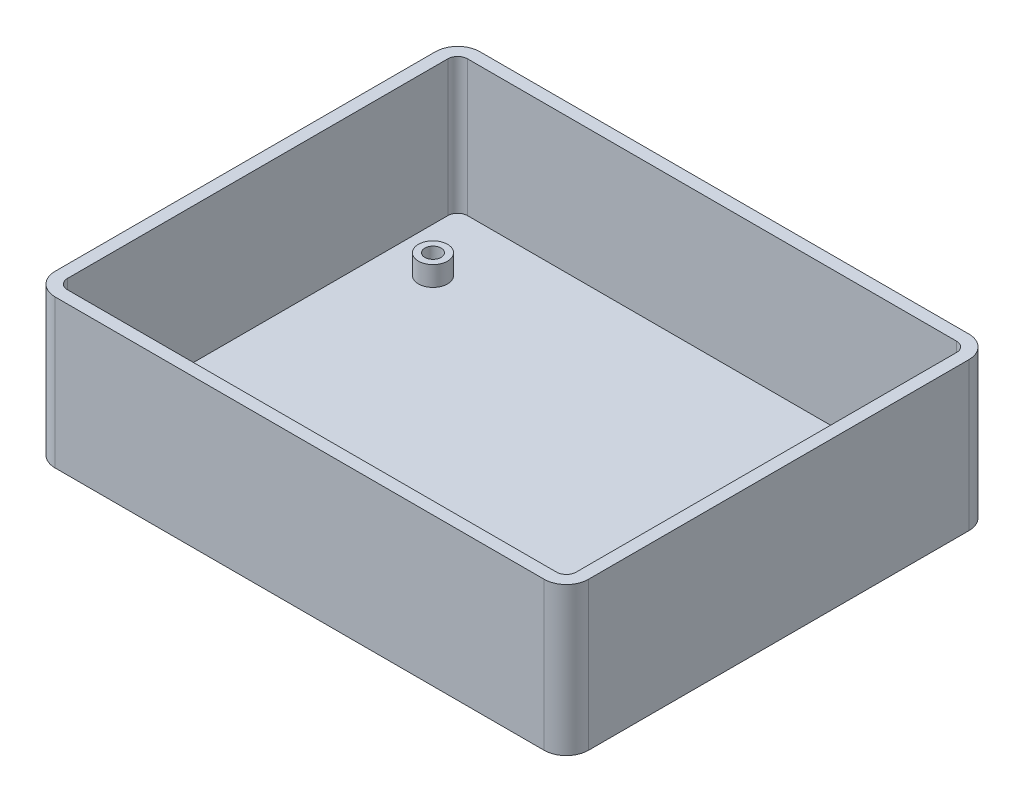
from build123d import *

# Parameters (mm, degrees)
SKETCH_1_W      = 103
SKETCH_1_H      = 81
SKETCH_1_R      = 1.65
EXTRUDE_1_DEPTH = 2.5
FILLET_1_R      = 2
EXTRUDE_START   = -30
EXTRUDE_2_DEPTH = 30
SKETCH_5_R      = 2.95
SKETCH_5_R_2    = 1.65
EXTRUDE_3_DEPTH = 4


with BuildPart() as part:
    # 草图1 → 凸台-拉伸1 (new body)
    with BuildSketch(Plane(origin=(0, 0, 0), x_dir=(1, 0, 0), z_dir=(0, 1, 0))):
        with Locations((1.5, 4.5)):
            Rectangle(SKETCH_1_W, SKETCH_1_H)
        with Locations(Location((41, 31, 0), (0, 0, 270))):
            Circle(SKETCH_1_R, mode=Mode.SUBTRACT)
        with Locations(Location((41, -31, 0), (0, 0, 270))):
            Circle(SKETCH_1_R, mode=Mode.SUBTRACT)
        with Locations(Location((-41, -31, 0), (0, 0, 270))):
            Circle(SKETCH_1_R, mode=Mode.SUBTRACT)
        with Locations(Location((-41, 31, 0), (0, 0, 270))):
            Circle(SKETCH_1_R, mode=Mode.SUBTRACT)
    extrude(amount=EXTRUDE_1_DEPTH)

    # 圆角1
    fillet_1_edges = [part.edges().sort_by_distance(p)[0] for p in [
        (-50, 1.25, -45),
        (53, 1.25, -45),
        (53, 1.25, 36),
        (-50, 1.25, 36),
    ]]
    fillet(fillet_1_edges, radius=FILLET_1_R)

    # 草图4 → 凸台-拉伸2 (add)
    with BuildSketch(Plane.XZ.offset(EXTRUDE_START)):
        with BuildLine():
            Line((51, 38.5), (-48, 38.5))
            ThreePointArc((-48, 38.5), (-51.181980515, 37.181980515), (-52.5, 34))
            Line((-52.5, 34), (-52.5, -43))
            ThreePointArc((-52.5, -43), (-51.181980515, -46.181980515), (-48, -47.5))
            Line((-48, -47.5), (51, -47.5))
            ThreePointArc((51, -47.5), (54.181980515, -46.181980515), (55.5, -43))
            Line((55.5, -43), (55.5, 34))
            ThreePointArc((55.5, 34), (54.181980515, 37.181980515), (51, 38.5))
        make_face()
        with BuildLine():
            Line((51, 36), (-48, 36))
            ThreePointArc((-48, 36), (-49.414213562, 35.414213562), (-50, 34))
            Line((-50, 34), (-50, -43))
            ThreePointArc((-50, -43), (-49.414213562, -44.414213562), (-48, -45))
            Line((-48, -45), (51, -45))
            ThreePointArc((51, -45), (52.414213562, -44.414213562), (53, -43))
            Line((53, -43), (53, 34))
            ThreePointArc((53, 34), (52.414213562, 35.414213562), (51, 36))
        make_face(mode=Mode.SUBTRACT)
    extrude(amount=EXTRUDE_2_DEPTH)

    # 草图5 → 凸台-拉伸3 (add)
    # profile 1 of 4: a face of its own
    with BuildSketch(Plane(origin=(0, 2.5, 0), x_dir=(1, 0, 0), z_dir=(0, 1, 0))):
        with Locations(Location((-41, -31, 0), (0, 0, 270))):
            Circle(SKETCH_5_R)
        with Locations(Location((-41, -31, 0), (0, 0, 270))):
            Circle(SKETCH_5_R_2, mode=Mode.SUBTRACT)
    # profile 2 of 4: a face of its own
    with BuildSketch(Plane(origin=(0, 2.5, 0), x_dir=(1, 0, 0), z_dir=(0, 1, 0))):
        with Locations(Location((41, -31, 0), (0, 0, 270))):
            Circle(SKETCH_5_R)
        with Locations(Location((41, -31, 0), (0, 0, 270))):
            Circle(SKETCH_5_R_2, mode=Mode.SUBTRACT)
    # profile 3 of 4: a face of its own
    with BuildSketch(Plane(origin=(0, 2.5, 0), x_dir=(1, 0, 0), z_dir=(0, 1, 0))):
        with Locations(Location((41, 31, 0), (0, 0, 270))):
            Circle(SKETCH_5_R)
        with Locations(Location((41, 31, 0), (0, 0, 270))):
            Circle(SKETCH_5_R_2, mode=Mode.SUBTRACT)
    # profile 4 of 4: a face of its own
    with BuildSketch(Plane(origin=(0, 2.5, 0), x_dir=(1, 0, 0), z_dir=(0, 1, 0))):
        with Locations(Location((-41, 31, 0), (0, 0, 270))):
            Circle(SKETCH_5_R)
        with Locations(Location((-41, 31, 0), (0, 0, 270))):
            Circle(SKETCH_5_R_2, mode=Mode.SUBTRACT)
    extrude(amount=EXTRUDE_3_DEPTH)


solid = part.part
